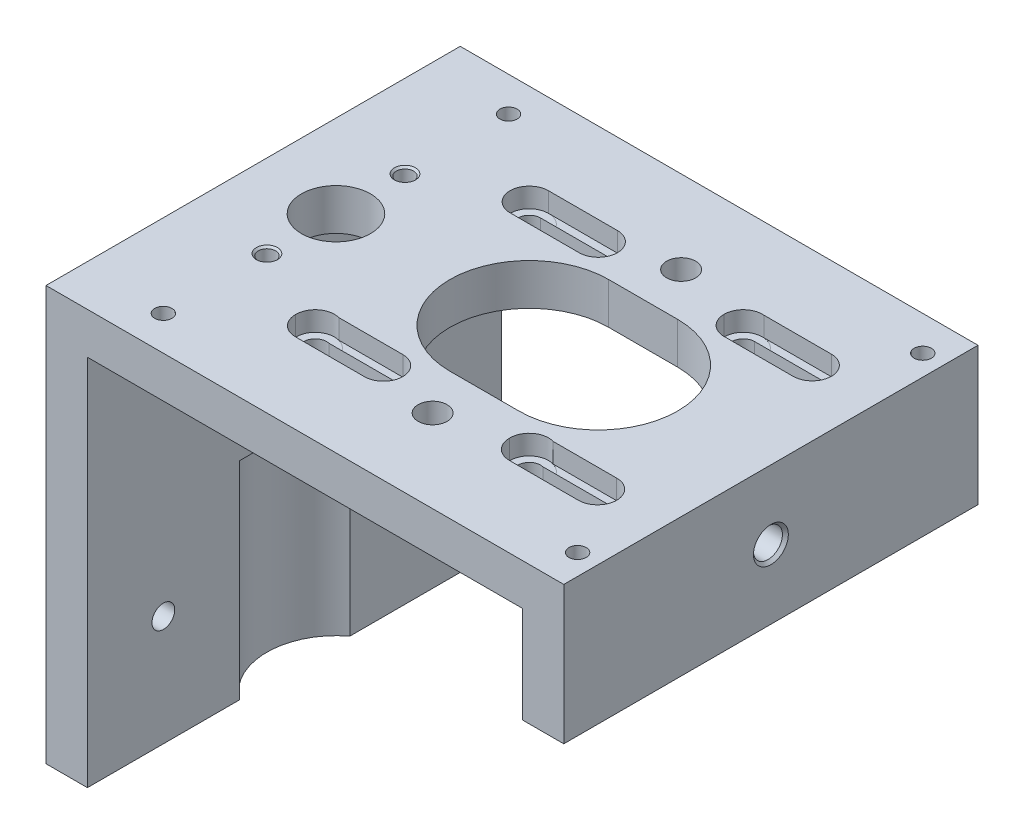
from build123d import *

# Parameters (mm, degrees)
BOSS_EXTRUDE1_DEPTH                            = 60
CUT_EXTRUDE1_DEPTH                             = 114.247516529
CBORE_FOR_4_SOCKET_HEAD_CAP_SCREW1_D           = 3.2639
CBORE_FOR_4_SOCKET_HEAD_CAP_SCREW1_CBORE_D     = 5.55752
CBORE_FOR_4_SOCKET_HEAD_CAP_SCREW1_CBORE_DEPTH = 2.8448
CUT_EXTRUDE5_REACH                             = 115.248
CUT_EXTRUDE6_DEPTH                             = 2.84
M3_TAPPED_HOLE1_D                              = 2.5
M3_TAPPED_HOLE1_DEPTH                          = 8.5
M3_TAPPED_HOLE1_TIP                            = 0.751075774
M5_TAPPED_HOLE1_D                              = 4.2
SKETCH11_R                                     = 5
CUT_EXTRUDE2_DEPTH                             = 114.247516529
M4_TAPPED_HOLE1_D                              = 3.3
M4_TAPPED_HOLE1_DEPTH                          = 6
M4_TAPPED_HOLE1_CSINK_D                        = 4.5
M4_TAPPED_HOLE1_CSINK_ANGLE                    = 90
M5_TAPPED_HOLE2_D                              = 4.2
M5_TAPPED_HOLE2_DEPTH                          = 6
M5_TAPPED_HOLE2_CSINK_D                        = 5.05
M5_TAPPED_HOLE2_CSINK_ANGLE                    = 90
SKETCH16_R                                     = 10
CUT_EXTRUDE4_DEPTH                             = 30
M3_TAPPED_HOLE2_AT_2_COUNT                     = 2
M3_TAPPED_HOLE2_AT_2_PITCH                     = 20


with BuildPart() as part:
    # Sketch1 → Boss-Extrude1 (new body)
    with BuildSketch(Plane.XY):
        Polygon((0, 0), (6, 0), (6, 54), (69, 54), (69, 40), (75, 40), (75, 60), (0, 60), align=None)
    extrude(amount=BOSS_EXTRUDE1_DEPTH)

    # Sketch2 → Cut-Extrude1 (cut, through all)
    with BuildSketch(Plane(origin=(0, 60, 0), x_dir=(1, 0, 0), z_dir=(0, 1, 0))):
        with BuildLine():
            Line((40, -18.5), (50, -18.5))
            ThreePointArc((50, -18.5), (61.5, -30), (50, -41.5))
            Line((50, -41.5), (40, -41.5))
            ThreePointArc((40, -41.5), (28.5, -30), (40, -18.5))
        make_face()
    extrude(amount=-CUT_EXTRUDE1_DEPTH, mode=Mode.SUBTRACT)

    # CBORE for #4 Socket Head Cap Screw1 (through all)
    with Locations(Plane(origin=(0, 60, 0), x_dir=(-1, 0, 0), z_dir=(0, 1, 0))):
        with Locations((-24.5, 45.5), (-55.5, 45.5), (-24.5, 14.5), (-55.5, 14.5)):
            CounterBoreHole(CBORE_FOR_4_SOCKET_HEAD_CAP_SCREW1_D / 2, CBORE_FOR_4_SOCKET_HEAD_CAP_SCREW1_CBORE_D / 2, CBORE_FOR_4_SOCKET_HEAD_CAP_SCREW1_CBORE_DEPTH)

    # Sketch24 → Cut-Extrude5 (cut, up to next)
    with BuildSketch(Plane(origin=(0, 60, 0), x_dir=(1, 0, 0), z_dir=(0, 1, 0)), mode=Mode.PRIVATE) as cut_extrude5_sk1:
        with BuildLine():
            Line((24.5, -12.86805), (34.5, -12.86805))
            ThreePointArc((34.5, -12.86805), (36.13195, -14.5), (34.5, -16.13195))
            Line((34.5, -16.13195), (24.5, -16.13195))
            ThreePointArc((24.5, -16.13195), (22.86805, -14.5), (24.5, -12.86805))
        make_face()
    cut_extrude5_tool1 = extrude(cut_extrude5_sk1.sketch, amount=-CUT_EXTRUDE5_REACH, mode=Mode.PRIVATE) & part.part
    # Sketch24 → Cut-Extrude5 (cut, up to next)
    with BuildSketch(Plane(origin=(0, 60, 0), x_dir=(1, 0, 0), z_dir=(0, 1, 0)), mode=Mode.PRIVATE) as cut_extrude5_sk2:
        with BuildLine():
            Line((55.5, -12.86805), (65.5, -12.86805))
            ThreePointArc((65.5, -12.86805), (67.13195, -14.5), (65.5, -16.13195))
            Line((65.5, -16.13195), (55.5, -16.13195))
            ThreePointArc((55.5, -16.13195), (53.86805, -14.5), (55.5, -12.86805))
        make_face()
    cut_extrude5_tool2 = extrude(cut_extrude5_sk2.sketch, amount=-CUT_EXTRUDE5_REACH, mode=Mode.PRIVATE) & part.part
    # Sketch24 → Cut-Extrude5 (cut, up to next)
    with BuildSketch(Plane(origin=(0, 60, 0), x_dir=(1, 0, 0), z_dir=(0, 1, 0)), mode=Mode.PRIVATE) as cut_extrude5_sk3:
        with BuildLine():
            Line((24.5, -43.911016089), (34.5, -43.911016089))
            ThreePointArc((34.5, -43.911016089), (36.13195, -45.542966089), (34.5, -47.174916089))
            Line((34.5, -47.174916089), (24.5, -47.174916089))
            ThreePointArc((24.5, -47.174916089), (22.86805, -45.542966089), (24.5, -43.911016089))
        make_face()
    cut_extrude5_tool3 = extrude(cut_extrude5_sk3.sketch, amount=-CUT_EXTRUDE5_REACH, mode=Mode.PRIVATE) & part.part
    # Sketch24 → Cut-Extrude5 (cut, up to next)
    with BuildSketch(Plane(origin=(0, 60, 0), x_dir=(1, 0, 0), z_dir=(0, 1, 0)), mode=Mode.PRIVATE) as cut_extrude5_sk4:
        with BuildLine():
            Line((55.5, -43.911016089), (65.5, -43.911016089))
            ThreePointArc((65.5, -43.911016089), (67.13195, -45.542966089), (65.5, -47.174916089))
            Line((65.5, -47.174916089), (55.5, -47.174916089))
            ThreePointArc((55.5, -47.174916089), (53.86805, -45.542966089), (55.5, -43.911016089))
        make_face()
    cut_extrude5_tool4 = extrude(cut_extrude5_sk4.sketch, amount=-CUT_EXTRUDE5_REACH, mode=Mode.PRIVATE) & part.part
    add(cut_extrude5_tool1.solids().sort_by_distance((29.5, 60, 14.5))[0], mode=Mode.SUBTRACT)
    add(cut_extrude5_tool2.solids().sort_by_distance((60.5, 60, 14.5))[0], mode=Mode.SUBTRACT)
    add(cut_extrude5_tool3.solids().sort_by_distance((29.5, 60, 45.542966))[0], mode=Mode.SUBTRACT)
    add(cut_extrude5_tool4.solids().sort_by_distance((60.5, 60, 45.542966))[0], mode=Mode.SUBTRACT)

    # Sketch25 → Cut-Extrude6 (cut)
    with BuildSketch(Plane(origin=(0, 60, 0), x_dir=(1, 0, 0), z_dir=(0, 1, 0))):
        with BuildLine():
            Line((24.5, -11.72124), (34.5, -11.72124))
            ThreePointArc((34.5, -11.72124), (37.27876, -14.5), (34.5, -17.27876))
            Line((34.5, -17.27876), (24.5, -17.27876))
            ThreePointArc((24.5, -17.27876), (21.72124, -14.5), (24.5, -11.72124))
        make_face()
        with BuildLine():
            Line((55.499999686, -11.73110797), (65.499999686, -11.73110797))
            ThreePointArc((65.499999686, -11.73110797), (68.278759686, -14.50986797), (65.499999686, -17.28862797))
            Line((65.499999686, -17.28862797), (55.499999686, -17.28862797))
            ThreePointArc((55.499999686, -17.28862797), (52.721239686, -14.50986797), (55.499999686, -11.73110797))
        make_face()
        with BuildLine():
            Line((24.5, -42.822083884), (34.5, -42.822083884))
            ThreePointArc((34.5, -42.822083884), (37.27876, -45.600843884), (34.5, -48.379603884))
            Line((34.5, -48.379603884), (24.5, -48.379603884))
            ThreePointArc((24.5, -48.379603884), (21.72124, -45.600843884), (24.5, -42.822083884))
        make_face()
        with BuildLine():
            Line((55.499999686, -42.831951854), (65.499999686, -42.831951854))
            ThreePointArc((65.499999686, -42.831951854), (68.278759686, -45.610711854), (65.499999686, -48.389471854))
            Line((65.499999686, -48.389471854), (55.499999686, -48.389471854))
            ThreePointArc((55.499999686, -48.389471854), (52.721239686, -45.610711854), (55.499999686, -42.831951854))
        make_face()
    extrude(amount=-CUT_EXTRUDE6_DEPTH, mode=Mode.SUBTRACT)

    # M3 Tapped Hole1
    with Locations(Plane(origin=(0, 60, 0), x_dir=(-1, 0, 0), z_dir=(0, 1, 0))):
        with Locations((-12, 55), (-72, 55), (-12, 5), (-72, 5)):
            Hole(M3_TAPPED_HOLE1_D / 2, depth=M3_TAPPED_HOLE1_DEPTH)
            with Locations((0, 0, -(M3_TAPPED_HOLE1_DEPTH + M3_TAPPED_HOLE1_TIP / 2))):  # 118° drill point
                Cone(0, M3_TAPPED_HOLE1_D / 2, M3_TAPPED_HOLE1_TIP, mode=Mode.SUBTRACT)

    # M5 Tapped Hole1 (through all)
    with Locations(Plane(origin=(0, 60, 0), x_dir=(-1, 0, 0), z_dir=(0, 1, 0))):
        with Locations((-44, 12), (-44, 48)):
            Hole(M5_TAPPED_HOLE1_D / 2)

    # Sketch11 → Cut-Extrude2 (cut, through all)
    with BuildSketch(Plane(origin=(0, 60, 0), x_dir=(1, 0, 0), z_dir=(0, 1, 0))):
        with Locations(Location((12, -30, 0), (0, 0, 270))):
            Circle(SKETCH11_R)
    extrude(amount=-CUT_EXTRUDE2_DEPTH, mode=Mode.SUBTRACT)

    # M4 Tapped Hole1
    with Locations(Plane.ZY):
        with Locations((11, 46), (11, 16), (49, 46), (49, 16)):
            CounterSinkHole(M4_TAPPED_HOLE1_D / 2, M4_TAPPED_HOLE1_CSINK_D / 2, depth=M4_TAPPED_HOLE1_DEPTH, counter_sink_angle=M4_TAPPED_HOLE1_CSINK_ANGLE)

    # M5 Tapped Hole2
    with Locations(Plane(origin=(75, 0, 0), x_dir=(0, 0, -1), z_dir=(1, 0, 0))):
        with Locations((-30, 50)):
            CounterSinkHole(M5_TAPPED_HOLE2_D / 2, M5_TAPPED_HOLE2_CSINK_D / 2, depth=M5_TAPPED_HOLE2_DEPTH, counter_sink_angle=M5_TAPPED_HOLE2_CSINK_ANGLE)

    # Sketch16 → Cut-Extrude4 (cut)
    with BuildSketch(Plane.XZ):
        with Locations((12, 30)):
            Circle(SKETCH16_R)
    extrude(amount=-CUT_EXTRUDE4_DEPTH, mode=Mode.SUBTRACT)

    # Sketch29 → M3 Tapped Hole2 (revolve, cut)
    with BuildSketch(Plane(origin=(12, 54, 40), x_dir=(0, 0, -1), z_dir=(1, 0, 0))):
        Polygon((0, 0), (0, 6), (1.525, 6), (1.25, 5.725), (1.25, 0.275), (1.525, 0), align=None)
    m3_tapped_hole2 = revolve(axis=Axis((12, 47.65, 40), (0, 1, 0)), mode=Mode.SUBTRACT)

    # M3 Tapped Hole2 at 2: M3 Tapped Hole2 ×2
    with Locations(*[(0, 0, -i * M3_TAPPED_HOLE2_AT_2_PITCH) for i in range(1, M3_TAPPED_HOLE2_AT_2_COUNT)]):
        add(m3_tapped_hole2, mode=Mode.SUBTRACT)


solid = part.part
